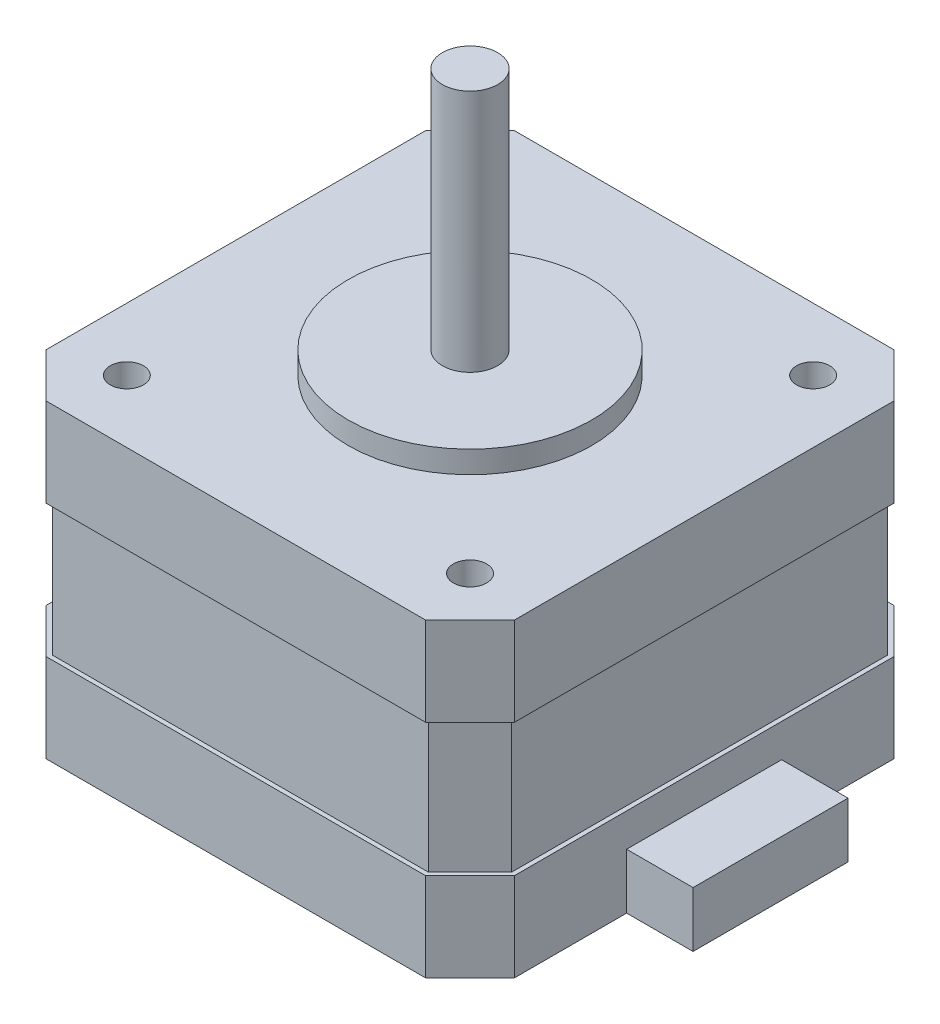
from build123d import *

# Parameters (mm, degrees)
SKETCH_2_W          = 42.3
SKETCH_2_H          = 42.3
EXTRUDE_1_DEPTH     = 28
SKETCH_3_R          = 11
EXTRUDE_2_DEPTH     = 2
EXTRUDE_START       = -2
SKETCH_4_R          = 2.5
EXTRUDE_3_DEPTH     = 24
SKETCH_5_R          = 1.5
CUT_EXTRUDE_1_DEPTH = 4.5
CHAMFER_1_SIZE      = 4
CUT_EXTRUDE_START   = -8
SKETCH_6_OUTSIDE_W  = 60.152
SKETCH_6_OUTSIDE_H  = 60.152
CUT_EXTRUDE_2_DEPTH = 12
SKETCH_7_R          = 2.5
EXTRUDE_4_DEPTH     = 2
CHAMFER_2_SIZE      = 1
SKETCH_8_W          = 14
SKETCH_8_H          = 5
EXTRUDE_5_DEPTH     = 6


with BuildPart() as part:
    # Эскиз2 → Бобышка-Вытянуть1 (new body)
    with BuildSketch(Plane(origin=(0, 0, 0), x_dir=(1, 0, 0), z_dir=(0, 1, 0))):
        Rectangle(SKETCH_2_W, SKETCH_2_H)
    extrude(amount=EXTRUDE_1_DEPTH)

    # Эскиз3 → Бобышка-Вытянуть2 (add)
    with BuildSketch(Plane(origin=(0, 28, 0), x_dir=(1, 0, 0), z_dir=(0, 1, 0))):
        with Locations(Location((0, 0, 0), (0, 0, 270))):
            Circle(SKETCH_3_R)
    extrude(amount=EXTRUDE_2_DEPTH)

    # Эскиз4 → Бобышка-Вытянуть3 (add)
    with BuildSketch(Plane(origin=(0, 30, 0), x_dir=(1, 0, 0), z_dir=(0, 1, 0)).offset(EXTRUDE_START)):
        with Locations(Location((0, 0, 0), (0, 0, 90))):
            Circle(SKETCH_4_R)
    extrude(amount=EXTRUDE_3_DEPTH)

    # Эскиз5 → Вырез-Вытянуть1 (cut)
    with BuildSketch(Plane(origin=(0, 28, 0), x_dir=(1, 0, 0), z_dir=(0, 1, 0))):
        with Locations(Location((-15.5, 15.5, 0), (0, 0, 270))):
            Circle(SKETCH_5_R)
        with Locations(Location((15.5, 15.5, 0), (0, 0, 270))):
            Circle(SKETCH_5_R)
        with Locations(Location((15.5, -15.5, 0), (0, 0, 270))):
            Circle(SKETCH_5_R)
        with Locations(Location((-15.5, -15.5, 0), (0, 0, 270))):
            Circle(SKETCH_5_R)
    extrude(amount=-CUT_EXTRUDE_1_DEPTH, mode=Mode.SUBTRACT)

    # Фаска1
    chamfer_1_edges = [part.edges().sort_by_distance(p)[0] for p in [
        (21.15, 14, 21.15),
        (-21.15, 14, 21.15),
        (-21.15, 14, -21.15),
        (21.15, 14, -21.15),
    ]]
    chamfer(chamfer_1_edges, length=CHAMFER_1_SIZE)

    # Эскиз6 outside → Вырез-Вытянуть2 (cut)
    with BuildSketch(Plane(origin=(0, 28, 0), x_dir=(1, 0, 0), z_dir=(0, 1, 0)).offset(CUT_EXTRUDE_START)):
        Rectangle(SKETCH_6_OUTSIDE_W, SKETCH_6_OUTSIDE_H)
        Polygon((-20.75, 16.984314575), (-20.75, -16.984314575), (-16.984314575, -20.75), (16.984314575, -20.75), (20.75, -16.984314575), (20.75, 16.984314575), (16.984314575, 20.75), (-16.984314575, 20.75), align=None, mode=Mode.SUBTRACT)
    extrude(amount=-CUT_EXTRUDE_2_DEPTH, mode=Mode.SUBTRACT)

    # Эскиз7 → Бобышка-Вытянуть4 (add)
    with BuildSketch(Plane.XZ):
        with Locations(Location((-15.5, -15.5, 0), (0, 0, 270))):
            Circle(SKETCH_7_R)
        with Locations(Location((15.5, -15.5, 0), (0, 0, 270))):
            Circle(SKETCH_7_R)
        with Locations(Location((15.5, 15.5, 0), (0, 0, 270))):
            Circle(SKETCH_7_R)
        with Locations(Location((-15.5, 15.5, 0), (0, 0, 270))):
            Circle(SKETCH_7_R)
    extrude(amount=EXTRUDE_4_DEPTH)

    # Фаска2
    chamfer_2_edges = [part.edges().sort_by_distance(p)[0] for p in [
        (-15.5, -2, -13),
        (15.5, -2, -13),
        (15.5, -2, 18),
        (-15.5, -2, 18),
    ]]
    chamfer(chamfer_2_edges, length=CHAMFER_2_SIZE)

    # Эскиз8 → Бобышка-Вытянуть5 (add)
    with BuildSketch(Plane(origin=(21.15, 0, 0), x_dir=(0, 0, -1), z_dir=(1, 0, 0))):
        with Locations((0, 2.5)):
            Rectangle(SKETCH_8_W, SKETCH_8_H)
    extrude(amount=EXTRUDE_5_DEPTH)


solid = part.part
